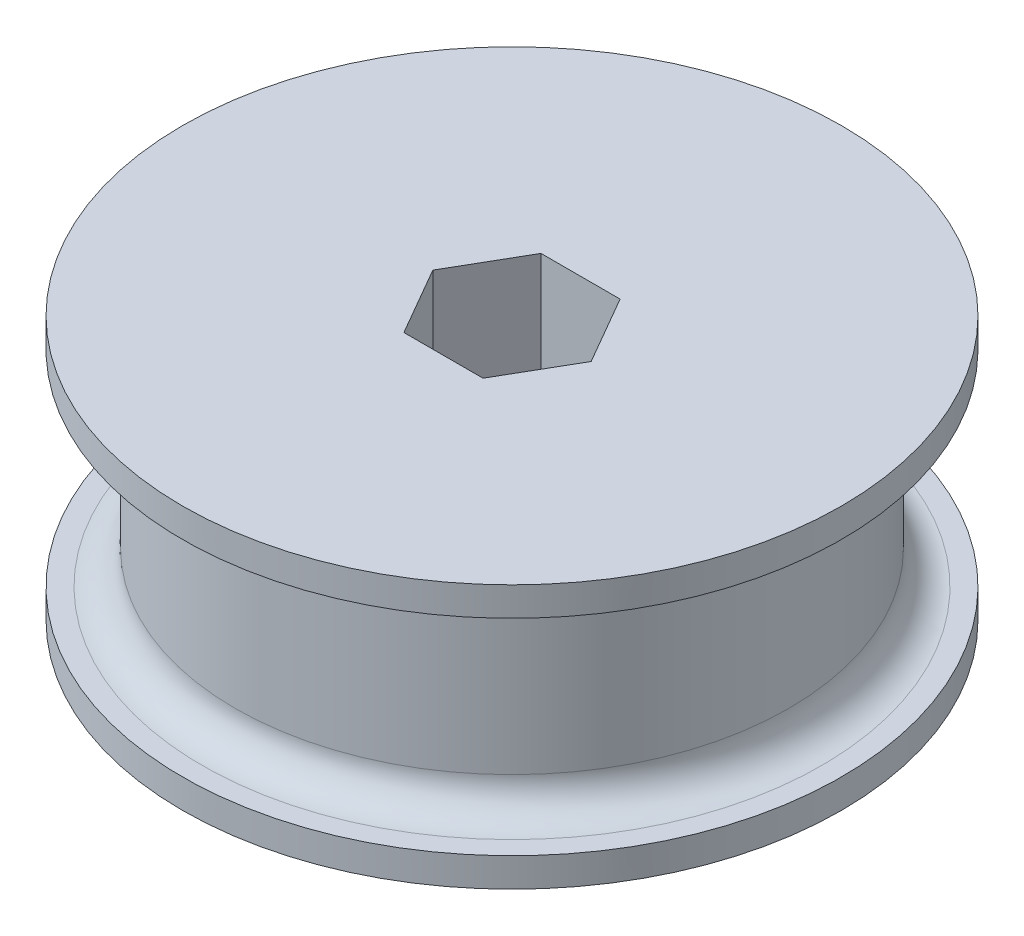
from build123d import *

# Parameters (mm, degrees)
SKETCH1_R           = 31.75
SKETCH1_R_2         = 5.0165
BOSS_EXTRUDE1_DEPTH = 25.4
CUT_EXTRUDE1_DEPTH  = 52.587643869


with BuildPart() as part:
    # Sketch1 → Boss-Extrude1 (new body)
    with BuildSketch(Plane(origin=(0, 0, 0), x_dir=(1, 0, 0), z_dir=(0, 1, 0))):
        Circle(SKETCH1_R)
        Circle(SKETCH1_R_2, mode=Mode.SUBTRACT)
    extrude(amount=BOSS_EXTRUDE1_DEPTH)

    # Sketch6 → Cut-Extrude1 (cut, through all)
    with BuildSketch(Plane(origin=(0, 25.4, 0), x_dir=(1, 0, 0), z_dir=(0, 1, 0))):
        Polygon((3.812821178, -6.604), (7.625642355, 0), (3.812821178, 6.604), (-3.812821178, 6.604), (-7.625642355, 0), (-3.812821178, -6.604), align=None)
    extrude(amount=-CUT_EXTRUDE1_DEPTH, mode=Mode.SUBTRACT)

    # Sketch2 → Cut-Revolve1 (revolve, cut)
    with BuildSketch(Plane.XY):
        with BuildLine():
            Line((31.75, 22.606), (29.845, 22.606))
            ThreePointArc((29.845, 22.606), (27.59993597, 21.67606403), (26.67, 19.431))
            Line((26.67, 19.431), (26.67, 5.969))
            ThreePointArc((26.67, 5.969), (27.59993597, 3.72393597), (29.845, 2.794))
            Line((29.845, 2.794), (31.75, 2.794))
            Line((31.75, 2.794), (31.75, 22.606))
        make_face()
    revolve(axis=Axis((0, 0, 0), (0, 1, 0)), mode=Mode.SUBTRACT)


solid = part.part
